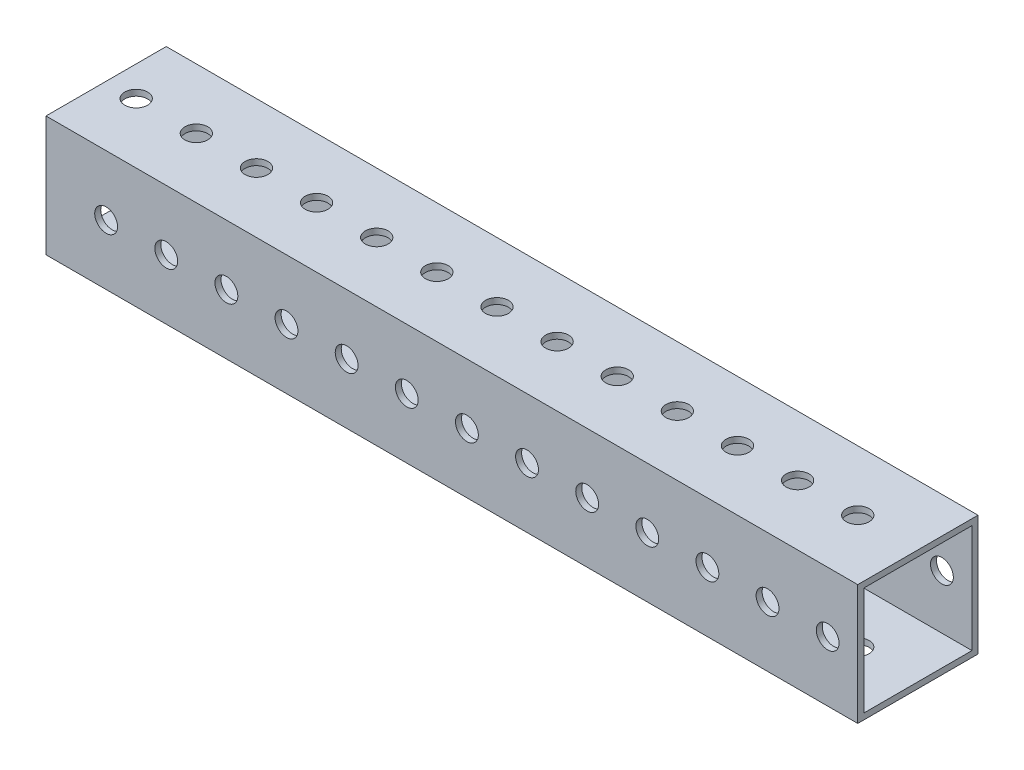
from build123d import *

# Parameters (mm, degrees)
SKETCH1_W           = 171.45
SKETCH1_H           = 25.4
BOSS_EXTRUDE1_DEPTH = 25.4
SKETCH2_W           = 22.86
SKETCH2_H           = 22.86
CUT_EXTRUDE1_DEPTH  = 176.172550646
SKETCH4_R           = 2.413
CUT_EXTRUDE2_DEPTH  = 176.172550646
SKETCH3_R           = 2.413
CUT_EXTRUDE3_DEPTH  = 176.172550646


with BuildPart() as part:
    # Sketch1 → Boss-Extrude1 (new body)
    with BuildSketch(Plane(origin=(0, 0, 0), x_dir=(1, 0, 0), z_dir=(0, 1, 0))):
        with Locations((85.725, 12.7)):
            Rectangle(SKETCH1_W, SKETCH1_H)
    extrude(amount=BOSS_EXTRUDE1_DEPTH)

    # Sketch2 → Cut-Extrude1 (cut, through all)
    with BuildSketch(Plane(origin=(171.45, 0, 0), x_dir=(0, 0, -1), z_dir=(1, 0, 0))):
        with Locations((12.7, 12.7)):
            Rectangle(SKETCH2_W, SKETCH2_H)
    extrude(amount=-CUT_EXTRUDE1_DEPTH, mode=Mode.SUBTRACT)

    # Sketch4 → Cut-Extrude2 (cut, through all)
    with BuildSketch(Plane(origin=(0, 0, -25.4), x_dir=(-1, 0, 0), z_dir=(0, 0, -1))):
        with Locations((-165.1, 12.7)):
            Circle(SKETCH4_R)
        with Locations((-152.4, 12.7)):
            Circle(SKETCH4_R)
        with Locations((-139.7, 12.7)):
            Circle(SKETCH4_R)
        with Locations((-127, 12.7)):
            Circle(SKETCH4_R)
        with Locations((-114.3, 12.7)):
            Circle(SKETCH4_R)
        with Locations((-101.6, 12.7)):
            Circle(SKETCH4_R)
        with Locations((-88.9, 12.7)):
            Circle(SKETCH4_R)
        with Locations((-76.2, 12.7)):
            Circle(SKETCH4_R)
        with Locations((-63.5, 12.7)):
            Circle(SKETCH4_R)
        with Locations((-50.8, 12.7)):
            Circle(SKETCH4_R)
        with Locations((-38.1, 12.7)):
            Circle(SKETCH4_R)
        with Locations((-25.4, 12.7)):
            Circle(SKETCH4_R)
        with Locations((-12.7, 12.7)):
            Circle(SKETCH4_R)
    extrude(amount=-CUT_EXTRUDE2_DEPTH, mode=Mode.SUBTRACT)

    # Sketch3 → Cut-Extrude3 (cut, through all)
    with BuildSketch(Plane(origin=(0, 25.4, 0), x_dir=(1, 0, 0), z_dir=(0, 1, 0))):
        with Locations(Location((6.35, 12.7, 0), (0, 0, 270))):
            Circle(SKETCH3_R)
        with Locations(Location((19.05, 12.7, 0), (0, 0, 270))):
            Circle(SKETCH3_R)
        with Locations(Location((31.75, 12.7, 0), (0, 0, 270))):
            Circle(SKETCH3_R)
        with Locations(Location((44.45, 12.7, 0), (0, 0, 270))):
            Circle(SKETCH3_R)
        with Locations(Location((57.15, 12.7, 0), (0, 0, 270))):
            Circle(SKETCH3_R)
        with Locations(Location((69.85, 12.7, 0), (0, 0, 270))):
            Circle(SKETCH3_R)
        with Locations(Location((82.55, 12.7, 0), (0, 0, 270))):
            Circle(SKETCH3_R)
        with Locations(Location((95.25, 12.7, 0), (0, 0, 270))):
            Circle(SKETCH3_R)
        with Locations(Location((107.95, 12.7, 0), (0, 0, 270))):
            Circle(SKETCH3_R)
        with Locations(Location((120.65, 12.7, 0), (0, 0, 270))):
            Circle(SKETCH3_R)
        with Locations(Location((133.35, 12.7, 0), (0, 0, 270))):
            Circle(SKETCH3_R)
        with Locations(Location((146.05, 12.7, 0), (0, 0, 270))):
            Circle(SKETCH3_R)
        with Locations(Location((158.75, 12.7, 0), (0, 0, 270))):
            Circle(SKETCH3_R)
    extrude(amount=-CUT_EXTRUDE3_DEPTH, mode=Mode.SUBTRACT)


solid = part.part
